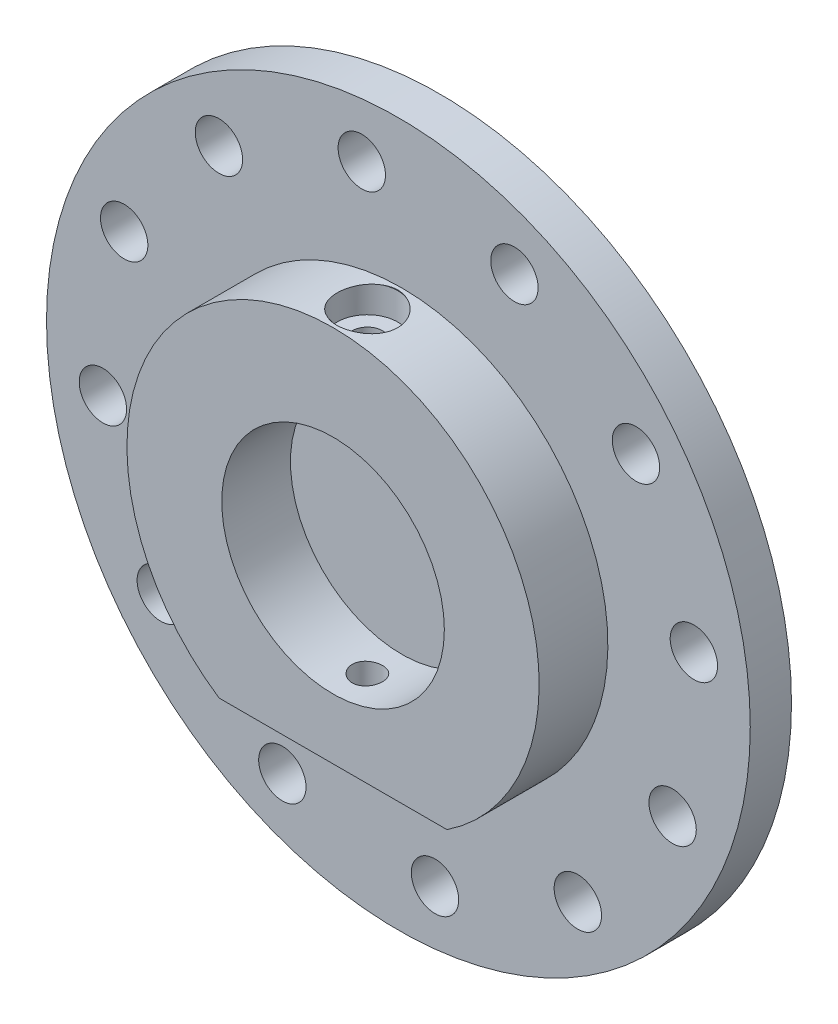
from build123d import *

# Parameters (mm, degrees)
SKETCH1_R           = 25.608746635
BOSS_EXTRUDE1_DEPTH = 3
SKETCH2_R           = 8.1
BOSS_EXTRUDE2_DEPTH = 5


with BuildPart() as part:
    # Sketch1 → Boss-Extrude1 (new body)
    with BuildSketch(Plane.XY):
        with Locations((-0.244898521, 0)):
            Circle(SKETCH1_R)
        with BuildLine():
            ThreePointArc((-18.841121629, 7.385104949), (-19.140852563, 9.804238645), (-21.559986259, 9.504507711))
            ThreePointArc((-21.559986259, 9.504507711), (-21.260255325, 7.085374015), (-18.841121629, 7.385104949))
        make_face(mode=Mode.SUBTRACT)
        with BuildLine():
            ThreePointArc((-20.389973917, -3.72411228), (-20.689704851, -1.304978585), (-23.108838546, -1.604709519))
            ThreePointArc((-23.108838546, -1.604709519), (-22.809107612, -4.023843215), (-20.389973917, -3.72411228))
        make_face(mode=Mode.SUBTRACT)
        with BuildLine():
            ThreePointArc((-16.176710729, -14.119402761), (-16.476441664, -11.700269066), (-18.895575359, -12))
            ThreePointArc((-18.895575359, -12), (-18.595844425, -14.419133695), (-16.176710729, -14.119402761))
        make_face(mode=Mode.SUBTRACT)
        with BuildLine():
            ThreePointArc((-7.330272536, -21.015356804), (-7.63000347, -18.596223108), (-10.049137166, -18.895954043))
            ThreePointArc((-10.049137166, -18.895954043), (-9.749406231, -21.315087738), (-7.330272536, -21.015356804))
        make_face(mode=Mode.SUBTRACT)
        with BuildLine():
            ThreePointArc((3.778944694, -22.564209091), (3.479213759, -20.145075396), (1.060080064, -20.44480633))
            ThreePointArc((1.060080064, -20.44480633), (1.359810998, -22.863940025), (3.778944694, -22.564209091))
        make_face(mode=Mode.SUBTRACT)
        with BuildLine():
            ThreePointArc((11.455370545, -16.231543143), (11.755101479, -18.650676838), (14.174235175, -18.350945904))
            ThreePointArc((14.174235175, -18.350945904), (13.87450424, -15.931812209), (11.455370545, -16.231543143))
        make_face(mode=Mode.SUBTRACT)
        with BuildLine():
            ThreePointArc((18.351324588, -7.385104949), (18.651055522, -9.804238645), (21.070189217, -9.504507711))
            ThreePointArc((21.070189217, -9.504507711), (20.770458283, -7.085374015), (18.351324588, -7.385104949))
        make_face(mode=Mode.SUBTRACT)
        with BuildLine():
            ThreePointArc((22.619041505, 1.604709519), (22.31931057, 4.023843215), (19.900176875, 3.72411228))
            ThreePointArc((19.900176875, 3.72411228), (20.199907809, 1.304978585), (22.619041505, 1.604709519))
        make_face(mode=Mode.SUBTRACT)
        with BuildLine():
            ThreePointArc((15.686913688, 14.119402761), (15.986644622, 11.700269066), (18.405778317, 12))
            ThreePointArc((18.405778317, 12), (18.106047383, 14.419133695), (15.686913688, 14.119402761))
        make_face(mode=Mode.SUBTRACT)
        with BuildLine():
            ThreePointArc((6.840475494, 21.015356804), (7.140206429, 18.596223108), (9.559340124, 18.895954043))
            ThreePointArc((9.559340124, 18.895954043), (9.25960919, 21.315087738), (6.840475494, 21.015356804))
        make_face(mode=Mode.SUBTRACT)
        with BuildLine():
            ThreePointArc((-4.268741735, 22.564209091), (-3.969010801, 20.145075396), (-1.549877106, 20.44480633))
            ThreePointArc((-1.549877106, 20.44480633), (-1.84960804, 22.863940025), (-4.268741735, 22.564209091))
        make_face(mode=Mode.SUBTRACT)
        with BuildLine():
            ThreePointArc((-14.664032216, 18.350945904), (-14.364301282, 15.931812209), (-11.945167587, 16.231543143))
            ThreePointArc((-11.945167587, 16.231543143), (-12.244898521, 18.650676838), (-14.664032216, 18.350945904))
        make_face(mode=Mode.SUBTRACT)
    extrude(amount=BOSS_EXTRUDE1_DEPTH)

    # Sketch2 → Boss-Extrude2 (add)
    with BuildSketch(Plane.XY.offset(3)):
        with BuildLine():
            Line((8.291561976, -12.5), (-8.291561976, -12.5))
            ThreePointArc((-8.291561976, -12.5), (0, 15), (8.291561976, -12.5))
        make_face()
        Circle(SKETCH2_R, mode=Mode.SUBTRACT)
    extrude(amount=BOSS_EXTRUDE2_DEPTH)

    # Sketch4 → CBORE for M2 SHCS1 (revolve, cut)
    with BuildSketch(Plane(origin=(0, 15, 5.5), x_dir=(0, 0, 1), z_dir=(1, 0, 0))):
        Polygon((0, 0), (0, 40.608746635), (1.1, 40.608746635), (1.1, 2), (2.2, 2), (2.2, 0.025), (2.225, 0), align=None)
    revolve(axis=Axis((0, 21.35, 5.5), (0, -1, 0)), mode=Mode.SUBTRACT)


solid = part.part
